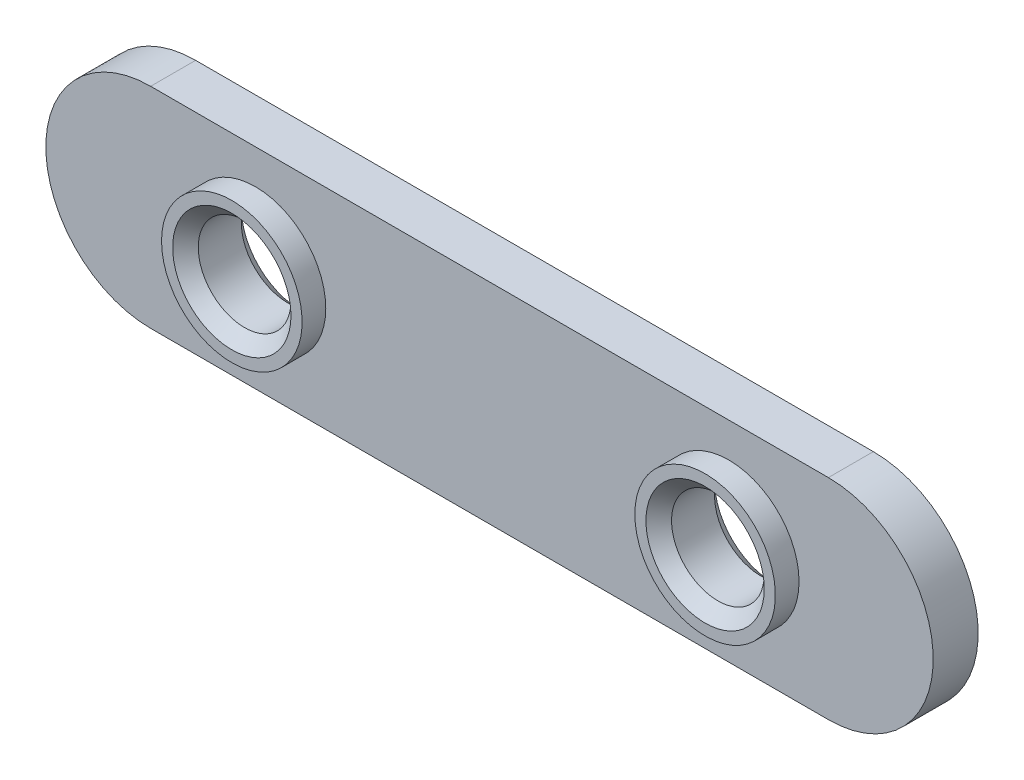
from build123d import *

# Parameters (mm, degrees)
BOSS_EXTRUDE1_DEPTH = 2.413
SKETCH2_W           = 3.7719
SKETCH2_H           = 1.27
SKETCH3_W           = 3.7719
SKETCH3_H           = 1.27
HOLE1_D             = 4.97586
HOLE1_CSINK_D       = 6.35
HOLE1_CSINK_ANGLE   = 90
CHAMFER1_SIZE       = 0.68707


with BuildPart() as part:
    # Sketch1 → Boss-Extrude1 (new body)
    with BuildSketch(Plane.XY.offset(1.2065)):
        with BuildLine():
            Line((30.7467, 5.6261), (-5.6261, 5.6261))
            ThreePointArc((-5.6261, 5.6261), (-11.2522, 0), (-5.6261, -5.6261))
            Line((-5.6261, -5.6261), (30.7467, -5.6261))
            ThreePointArc((30.7467, -5.6261), (36.3728, 0), (30.7467, 5.6261))
        make_face()
    extrude(amount=-BOSS_EXTRUDE1_DEPTH)

    # Sketch2 → Revolve1 (revolve)
    with BuildSketch(Plane.XZ, mode=Mode.PRIVATE) as revolve1_sk:
        with Locations((1.88595, 1.8415)):
            Rectangle(SKETCH2_W, SKETCH2_H)
    revolve(revolve1_sk.sketch.rotate(Axis((0, 0, 2.4765), (0, 0, -1)), 180), axis=Axis((0, 0, 2.4765), (0, 0, -1)))

    # Sketch3 → Revolve2 (revolve)
    with BuildSketch(Plane.XZ, mode=Mode.PRIVATE) as revolve2_sk:
        with Locations((27.28595, 1.8415)):
            Rectangle(SKETCH3_W, SKETCH3_H)
    revolve(revolve2_sk.sketch.rotate(Axis((25.4, 0, 2.4765), (0, 0, -1)), 180), axis=Axis((25.4, 0, 2.4765), (0, 0, -1)))

    # Hole1 (through all)
    with Locations(Plane.XY.offset(2.4765)):
        with Locations((0, 0), (25.4, 0)):
            CounterSinkHole(HOLE1_D / 2, HOLE1_CSINK_D / 2, counter_sink_angle=HOLE1_CSINK_ANGLE)

    # Chamfer1
    chamfer1_edges = [part.edges().sort_by_distance(p)[0] for p in [
        (27.88793, 0, -1.2065),
        (2.48793, 0, -1.2065),
    ]]
    chamfer(chamfer1_edges, length=CHAMFER1_SIZE)


solid = part.part
